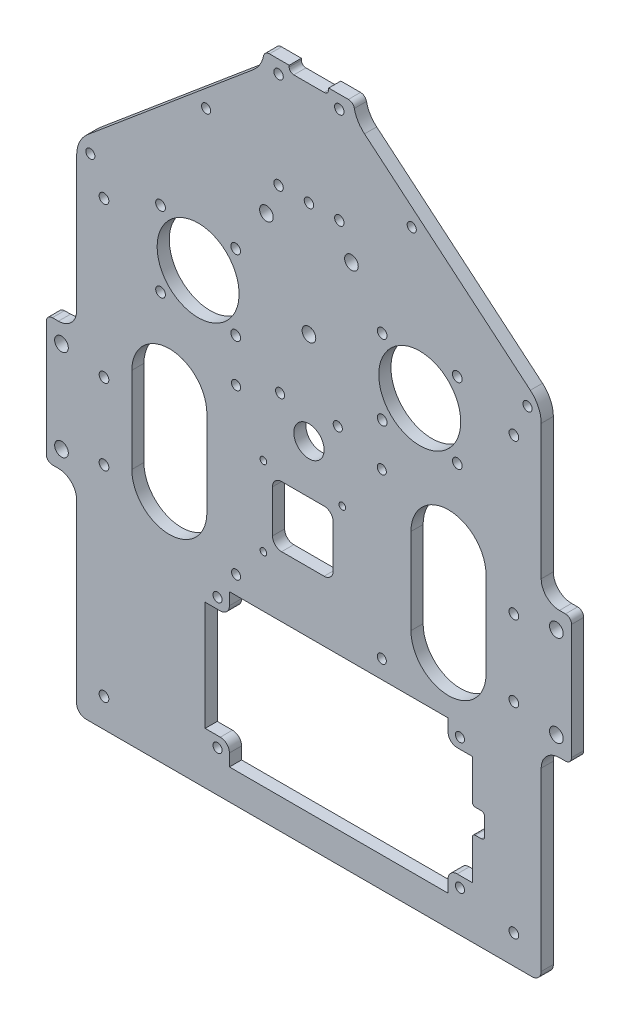
from build123d import *

# Parameters (mm, degrees)
SKETCH_1_R           = 2.25
SKETCH_1_R_2         = 13.5
SKETCH_1_R_3         = 1.6
SKETCH_1_R_4         = 1.55
EXTRUDE_1_DEPTH      = 4
SKETCH_2_R           = 2.25
EXTRUDE_2_DEPTH      = 4
CUT_EXTRUDE_2_DEPTH  = 10
SKETCH_6_R           = 2.25
EXTRUDE_3_DEPTH      = 4
SKETCH_7_R           = 2.25
SKETCH_7_R_2         = 2.390826743
EXTRUDE_5_DEPTH      = 4
SKETCH_10_R          = 1.6
CUT_EXTRUDE_3_DEPTH  = 6
SKETCH_11_W          = 153
SKETCH_11_H          = 60
EXTRUDE_6_DEPTH      = 4
SKETCH_12_R          = 1.5
CUT_EXTRUDE_4_DEPTH  = 10
SKETCH_14_W          = 10
SKETCH_14_H          = 42
SKETCH_14_R          = 2.25
EXTRUDE_7_DEPTH      = 4
FILLET_1_R           = 6
SKETCH_15_R          = 1.1
CUT_EXTRUDE_6_DEPTH  = 4
EXTRUDE_9_DEPTH      = 4
FILLET_8_R           = 2
SKETCH_18_W          = 88
SKETCH_18_H          = 50
CUT_EXTRUDE_7_DEPTH  = 10
SKETCH_19_W          = 8
SKETCH_19_H          = 7
EXTRUDE_10_DEPTH     = 4
FILLET_9_R           = 3
SKETCH_20_R          = 1.5
CUT_EXTRUDE_8_DEPTH  = 4
FILLET_10_R          = 3
SKETCH_21_W          = 8
SKETCH_21_H          = 8
CUT_EXTRUDE_10_DEPTH = 4
FILLET_12_R          = 1
CUT_EXTRUDE_11_DEPTH = 4
SKETCH_23_R          = 1.5
CUT_EXTRUDE_12_DEPTH = 10
SKETCH_24_R          = 1.5
CUT_EXTRUDE_13_DEPTH = 10
SKETCH_25_R          = 1.5
CUT_EXTRUDE_14_DEPTH = 10
SKETCH_27_R          = 5
CUT_EXTRUDE_15_DEPTH = 10
CUT_EXTRUDE_16_DEPTH = 10
FILLET_5_R           = 10
FILLET_6_R           = 10
SKETCH_31_R          = 1.6
CUT_EXTRUDE_17_DEPTH = 10


with BuildPart() as part:
    # 草图1 → 凸台-拉伸1 (new body)
    with BuildSketch(Plane.XY):
        with BuildLine():
            Line((-20.113876697, 33.24519052), (-46.760858936, 18.322520948))
            ThreePointArc((-46.760858936, 18.322520948), (-54.272689389, -11.186219731), (-24.417808219, -17.176164932))
            Line((-24.417808219, -17.176164932), (-17.260273973, -12.141356418))
            ThreePointArc((-17.260273973, -12.141356418), (0, -6.678734892), (17.260273973, -12.141356418))
            Line((17.260273973, -12.141356418), (24.417808219, -17.176164932))
            ThreePointArc((24.417808219, -17.176164932), (54.272689389, -11.186219731), (46.760858936, 18.322520948))
            Line((46.760858936, 18.322520948), (20.113876697, 33.24519052))
            ThreePointArc((20.113876697, 33.24519052), (16.372681963, 36.913582704), (15, 41.970200496))
            Line((15, 41.970200496), (15, 71.5))
            ThreePointArc((15, 71.5), (14.414213562, 72.914213562), (13, 73.5))
            Line((13, 73.5), (-13, 73.5))
            ThreePointArc((-13, 73.5), (-14.414213562, 72.914213562), (-15, 71.5))
            Line((-15, 71.5), (-15, 41.970200496))
            ThreePointArc((-15, 41.970200496), (-16.372681963, 36.913582704), (-20.113876697, 33.24519052))
        make_face()
        with Locations((-14, 27.5)):
            Circle(SKETCH_1_R, mode=Mode.SUBTRACT)
        with Locations((14, 27.5)):
            Circle(SKETCH_1_R, mode=Mode.SUBTRACT)
        with Locations((36.5, 0)):
            Circle(SKETCH_1_R_2, mode=Mode.SUBTRACT)
        with Locations((24.125631329, 12.374368671)):
            Circle(SKETCH_1_R_3, mode=Mode.SUBTRACT)
        with Locations((48.874368671, 12.374368671)):
            Circle(SKETCH_1_R_3, mode=Mode.SUBTRACT)
        with Locations((48.874368671, -12.374368671)):
            Circle(SKETCH_1_R_3, mode=Mode.SUBTRACT)
        with Locations((24.125631329, -12.374368671)):
            Circle(SKETCH_1_R_3, mode=Mode.SUBTRACT)
        Circle(SKETCH_1_R, mode=Mode.SUBTRACT)
        with Locations(Location((-24.125631329, -12.374368671, 0), (0, 0, 180))):
            Circle(SKETCH_1_R_3, mode=Mode.SUBTRACT)
        with Locations(Location((-48.874368671, -12.374368671, 0), (0, 0, 180))):
            Circle(SKETCH_1_R_3, mode=Mode.SUBTRACT)
        with Locations(Location((-48.874368671, 12.374368671, 0), (0, 0, 180))):
            Circle(SKETCH_1_R_3, mode=Mode.SUBTRACT)
        with Locations(Location((-24.125631329, 12.374368671, 0), (0, 0, 180))):
            Circle(SKETCH_1_R_3, mode=Mode.SUBTRACT)
        with Locations(Location((-36.5, 0, 0), (0, 0, 180))):
            Circle(SKETCH_1_R_2, mode=Mode.SUBTRACT)
        with Locations((-10, 37.5)):
            Circle(SKETCH_1_R_4, mode=Mode.SUBTRACT)
        with Locations((10, 37.5)):
            Circle(SKETCH_1_R_4, mode=Mode.SUBTRACT)
        with Locations((-10, 69.2)):
            Circle(SKETCH_1_R_4, mode=Mode.SUBTRACT)
        with Locations((10, 69.2)):
            Circle(SKETCH_1_R_4, mode=Mode.SUBTRACT)
        with Locations((0, 37.5)):
            Circle(SKETCH_1_R_4, mode=Mode.SUBTRACT)
    extrude(amount=EXTRUDE_1_DEPTH)

    # 草图2 → 凸台-拉伸2 (add)
    # profile 1 of 2: a face of its own
    with BuildSketch(Plane(origin=(0, 0, 0), x_dir=(-1, 0, 0), z_dir=(0, 0, -1))):
        with BuildLine():
            Line((34.034193738, -20.854730866), (72.253806486, -25.373713204))
            ThreePointArc((72.253806486, -25.373713204), (75.224328093, -24.440381608), (76.5, -21.6))
            Line((76.5, -21.6), (76.5, 3.4))
            ThreePointArc((76.5, 3.4), (75.861721596, 5.507965026), (74.16130708, 6.907788708))
            Line((74.16130708, 6.907788708), (46.760858936, 18.322520948))
            ThreePointArc((46.760858936, 18.322520948), (56.47260565, -6.488067781), (34.034193738, -20.854730866))
        make_face()
        with Locations((72.7, 3.4)):
            Circle(SKETCH_2_R, mode=Mode.SUBTRACT)
        with Locations((72.7, -21.6)):
            Circle(SKETCH_2_R, mode=Mode.SUBTRACT)
    # profile 2 of 2: a face of its own
    with BuildSketch(Plane(origin=(0, 0, 0), x_dir=(-1, 0, 0), z_dir=(0, 0, -1))):
        with BuildLine():
            Line((-74.16130708, 6.907788708), (-46.760858936, 18.322520948))
            ThreePointArc((-46.760858936, 18.322520948), (-56.47260565, -6.488067781), (-34.034193738, -20.854730866))
            Line((-34.034193738, -20.854730866), (-72.253806486, -25.373713204))
            ThreePointArc((-72.253806486, -25.373713204), (-75.224328093, -24.440381608), (-76.5, -21.6))
            Line((-76.5, -21.6), (-76.5, 3.4))
            ThreePointArc((-76.5, 3.4), (-75.861721596, 5.507965026), (-74.16130708, 6.907788708))
        make_face()
        with Locations((-72.7, 3.4)):
            Circle(SKETCH_2_R, mode=Mode.SUBTRACT)
        with Locations((-72.7, -21.6)):
            Circle(SKETCH_2_R, mode=Mode.SUBTRACT)
    extrude(amount=-EXTRUDE_2_DEPTH)

    # 草图4 → 切除-拉伸2 (cut)
    with BuildSketch(Plane(origin=(0, 0, 0), x_dir=(-1, 0, 0), z_dir=(0, 0, -1))):
        with BuildLine():
            Line((6.5, 73.5), (-6.5, 73.5))
            Line((-6.5, 73.5), (-6.5, 73))
            ThreePointArc((-6.5, 73), (-6.060660172, 71.939339828), (-5, 71.5))
            Line((-5, 71.5), (5, 71.5))
            ThreePointArc((5, 71.5), (6.060660172, 71.939339828), (6.5, 73))
            Line((6.5, 73), (6.5, 73.5))
        make_face()
    extrude(amount=-CUT_EXTRUDE_2_DEPTH, mode=Mode.SUBTRACT)

    # 草图6 → 凸台-拉伸3 (add)
    with BuildSketch(Plane.XY):
        Polygon((-76.5, 3.4), (-76.5, -86.5), (76.5, -86.5), (76.5, 3.4), (53.144000112, -23.114222035), (20.839041096, -14.658760675), (2.25, 0), (2.25, -4.271102927), (-2.25, -4.271102927), (-2.25, 0), (-20.839041096, -14.658760675), (-53.144000112, -23.114222035), align=None)
        with Locations(Location((-72.7, -21.6, 0), (0, 0, 180))):
            Circle(SKETCH_6_R, mode=Mode.SUBTRACT)
        with Locations(Location((72.7, -21.6, 0), (0, 0, 180))):
            Circle(SKETCH_6_R, mode=Mode.SUBTRACT)
    extrude(amount=EXTRUDE_3_DEPTH)

    # 草图7 → 凸台-拉伸5 (add)
    with BuildSketch(Plane.XY):
        with Locations((-72.7, -21.6)):
            Circle(SKETCH_7_R)
        with Locations((72.7, 3.4)):
            Circle(SKETCH_7_R_2)
        with Locations((72.7, -21.6)):
            Circle(SKETCH_7_R)
        with Locations((-72.7, 3.4)):
            Circle(SKETCH_7_R)
    extrude(amount=EXTRUDE_5_DEPTH)

    # 草图10 → 切除-拉伸3 (cut)
    with BuildSketch(Plane.XY.offset(4)):
        with Locations((67.5, -46)):
            Circle(SKETCH_10_R)
        with Locations(Location((67.5, -71, 0), (0, 0, 180))):
            Circle(SKETCH_10_R)
        with Locations((-67.5, -71)):
            Circle(SKETCH_10_R)
        with Locations(Location((-67.5, -46, 0), (0, 0, 180))):
            Circle(SKETCH_10_R)
    extrude(amount=-CUT_EXTRUDE_3_DEPTH, mode=Mode.SUBTRACT)

    # 草图11 → 凸台-拉伸6 (add)
    with BuildSketch(Plane.XY):
        with Locations((0, -116.5)):
            Rectangle(SKETCH_11_W, SKETCH_11_H)
    extrude(amount=EXTRUDE_6_DEPTH)

    # 草图12 → 切除-拉伸4 (cut)
    with BuildSketch(Plane.XY.offset(4)):
        with Locations((24, -26.5)):
            Circle(SKETCH_12_R)
        with Locations(Location((-24, -26.5, 0), (0, 0, 180))):
            Circle(SKETCH_12_R)
        with Locations(Location((24, -80.5, 0), (0, 0, 180))):
            Circle(SKETCH_12_R)
        with Locations((-24, -80.5)):
            Circle(SKETCH_12_R)
    extrude(amount=-CUT_EXTRUDE_4_DEPTH, mode=Mode.SUBTRACT)

    # 草图14 → 凸台-拉伸7 (add)
    # profile 1 of 2: a face of its own
    with BuildSketch(Plane.XY.offset(4)):
        with Locations((-81.5, -58.5)):
            Rectangle(SKETCH_14_W, SKETCH_14_H)
        with Locations((-81.5, -43.5)):
            Circle(SKETCH_14_R, mode=Mode.SUBTRACT)
        with Locations((-81.5, -73.5)):
            Circle(SKETCH_14_R, mode=Mode.SUBTRACT)
    # profile 2 of 2: a face of its own
    with BuildSketch(Plane.XY.offset(4)):
        with Locations((81.5, -58.5)):
            Rectangle(SKETCH_14_W, SKETCH_14_H)
        with Locations(Location((81.5, -73.5, 0), (0, 0, 180))):
            Circle(SKETCH_14_R, mode=Mode.SUBTRACT)
        with Locations(Location((81.5, -43.5, 0), (0, 0, 180))):
            Circle(SKETCH_14_R, mode=Mode.SUBTRACT)
    extrude(amount=-EXTRUDE_7_DEPTH)

    # 圆角1
    fillet_1_edges = [part.edges().sort_by_distance(p)[0] for p in [
        (-76.5, -37.5, 2),
        (-76.5, -79.5, 2),
        (76.5, -37.5, 2),
        (76.5, -79.5, 2),
    ]]
    fillet(fillet_1_edges, radius=FILLET_1_R)

    # 草图15 → 切除-拉伸6 (cut)
    with BuildSketch(Plane.XY.offset(4)):
        with Locations((-15, -43.5)):
            Circle(SKETCH_15_R)
        with Locations((11, -43.5)):
            Circle(SKETCH_15_R)
        with Locations((-15, -69.5)):
            Circle(SKETCH_15_R)
    extrude(amount=-CUT_EXTRUDE_6_DEPTH, mode=Mode.SUBTRACT)

    # 草图17 → 凸台-拉伸9 (add)
    with BuildSketch(Plane.XY.offset(4)):
        Polygon((-76.5, 2.850902071), (-76.5, 17.5), (-15, 69.104627317), (-15, 31.936807034), align=None)
        Polygon((15, 31.936807034), (76.5, 2.850902071), (76.5, 17.5), (15, 69.104627317), align=None)
    extrude(amount=-EXTRUDE_9_DEPTH)

    # 圆角8
    fillet_8_edges = [part.edges().sort_by_distance(p)[0] for p in [
        (-86.5, -79.5, 2),
        (-86.5, -37.5, 2),
        (86.5, -37.5, 2),
        (86.5, -79.5, 2),
    ]]
    fillet(fillet_8_edges, radius=FILLET_8_R)

    # 草图18 → 切除-拉伸7 (cut)
    with BuildSketch(Plane.XY.offset(4)):
        with Locations((9.819218434, -111.5)):
            Rectangle(SKETCH_18_W, SKETCH_18_H)
    extrude(amount=-CUT_EXTRUDE_7_DEPTH, mode=Mode.SUBTRACT)

    # 草图19 → 凸台-拉伸10 (add)
    with BuildSketch(Plane.XY.offset(4)):
        with Locations((49.819218434, -90)):
            Rectangle(SKETCH_19_W, SKETCH_19_H)
        with Locations((-30.180781566, -90)):
            Rectangle(SKETCH_19_W, SKETCH_19_H)
        with Locations((49.819218434, -133)):
            Rectangle(SKETCH_19_W, SKETCH_19_H)
        with Locations((-30.180781566, -133)):
            Rectangle(SKETCH_19_W, SKETCH_19_H)
    extrude(amount=-EXTRUDE_10_DEPTH)

    # 圆角9
    fillet_9_edges = [part.edges().sort_by_distance(p)[0] for p in [
        (-26.180781566, -93.5, 2),
        (45.819218434, -93.5, 2),
        (45.819218434, -129.5, 2),
        (-26.180781566, -129.5, 2),
    ]]
    fillet(fillet_9_edges, radius=FILLET_9_R)

    # 草图20 → 切除-拉伸8 (cut)
    with BuildSketch(Plane.XY.offset(4)):
        with Locations((49.744218434, -90.025)):
            Circle(SKETCH_20_R)
        with Locations(Location((-30.105781566, -90.025, 0), (0, 0, 180))):
            Circle(SKETCH_20_R)
        with Locations(Location((49.744218434, -132.975, 0), (0, 0, 180))):
            Circle(SKETCH_20_R)
        with Locations((-30.105781566, -132.975)):
            Circle(SKETCH_20_R)
    extrude(amount=-CUT_EXTRUDE_8_DEPTH, mode=Mode.SUBTRACT)

    # 圆角10
    fillet_10_edges = [part.edges().sort_by_distance(p)[0] for p in [
        (-76.5, -146.5, 2),
        (76.5, -146.5, 2),
    ]]
    fillet(fillet_10_edges, radius=FILLET_10_R)

    # 草图21 → 切除-拉伸10 (cut)
    with BuildSketch(Plane.XY):
        with Locations((53.819218434, -111.5)):
            Rectangle(SKETCH_21_W, SKETCH_21_H)
    extrude(amount=CUT_EXTRUDE_10_DEPTH, mode=Mode.SUBTRACT)

    # 圆角12
    fillet_12_edges = [part.edges().sort_by_distance(p)[0] for p in [
        (53.819218434, -115.5, 2),
        (53.819218434, -107.5, 2),
        (57.819218434, -107.5, 2),
        (57.819218434, -115.5, 2),
    ]]
    fillet(fillet_12_edges, radius=FILLET_12_R)

    # 草图22 → 切除-拉伸11 (cut)
    with BuildSketch(Plane.XY.offset(4)):
        with BuildLine():
            Line((58.332035048, -39.43466915), (58.332035048, -67.717636053))
            ThreePointArc((58.332035048, -67.717636053), (45.971330995, -80.078340107), (33.610626941, -67.717636053))
            Line((33.610626941, -67.717636053), (33.610626941, -39.43466915))
            ThreePointArc((33.610626941, -39.43466915), (45.971330995, -27.073965096), (58.332035048, -39.43466915))
        make_face()
        with BuildLine():
            Line((-58.332035048, -39.43466915), (-58.332035048, -67.717636053))
            ThreePointArc((-58.332035048, -67.717636053), (-45.971330995, -80.078340107), (-33.610626941, -67.717636053))
            Line((-33.610626941, -67.717636053), (-33.610626941, -39.43466915))
            ThreePointArc((-33.610626941, -39.43466915), (-45.971330995, -27.073965096), (-58.332035048, -39.43466915))
        make_face()
    extrude(amount=-CUT_EXTRUDE_11_DEPTH, mode=Mode.SUBTRACT)

    # 草图23 → 切除-拉伸12 (cut)
    with BuildSketch(Plane(origin=(0, 0, 0), x_dir=(-1, 0, 0), z_dir=(0, 0, -1))):
        with Locations((-9.5, -21.5)):
            Circle(SKETCH_23_R)
        with Locations((9.5, -21.5)):
            Circle(SKETCH_23_R)
    extrude(amount=-CUT_EXTRUDE_12_DEPTH, mode=Mode.SUBTRACT)

    # 草图24 → 切除-拉伸13 (cut)
    with BuildSketch(Plane.XY.offset(4)):
        with Locations((-72, 15.5)):
            Circle(SKETCH_24_R)
        with Locations(Location((72, 15.5, 0), (0, 0, 180))):
            Circle(SKETCH_24_R)
    extrude(amount=-CUT_EXTRUDE_13_DEPTH, mode=Mode.SUBTRACT)

    # 草图25 → 切除-拉伸14 (cut)
    with BuildSketch(Plane.XY.offset(4)):
        with Locations((-33.863885037, 47.5)):
            Circle(SKETCH_25_R)
        with Locations(Location((33.863885037, 47.5, 0), (0, 0, 180))):
            Circle(SKETCH_25_R)
    extrude(amount=-CUT_EXTRUDE_14_DEPTH, mode=Mode.SUBTRACT)

    # 草图27 → 切除-拉伸15 (cut)
    with BuildSketch(Plane.XY.offset(4)):
        with Locations((0, -30.5)):
            Circle(SKETCH_27_R)
    extrude(amount=-CUT_EXTRUDE_15_DEPTH, mode=Mode.SUBTRACT)

    # 草图28 → 切除-拉伸16 (cut)
    with BuildSketch(Plane.XY.offset(4)):
        with BuildLine():
            Line((5, -66.5), (-9, -66.5))
            ThreePointArc((-9, -66.5), (-11.121320344, -65.621320344), (-12, -63.5))
            Line((-12, -63.5), (-12, -49.5))
            ThreePointArc((-12, -49.5), (-11.121320344, -47.378679656), (-9, -46.5))
            Line((-9, -46.5), (5, -46.5))
            ThreePointArc((5, -46.5), (7.121320344, -47.378679656), (8, -49.5))
            Line((8, -49.5), (8, -63.5))
            ThreePointArc((8, -63.5), (7.121320344, -65.621320344), (5, -66.5))
        make_face()
    extrude(amount=-CUT_EXTRUDE_16_DEPTH, mode=Mode.SUBTRACT)

    # 圆角5
    fillet_5_edges = [part.edges().sort_by_distance(p)[0] for p in [
        (-76.5, 17.5, 2),
        (76.5, 17.5, 2),
    ]]
    fillet(fillet_5_edges, radius=FILLET_5_R)

    # 圆角6
    fillet_6_edges = [part.edges().sort_by_distance(p)[0] for p in [
        (-15, 69.104627317, 2),
        (15, 69.104627317, 2),
    ]]
    fillet(fillet_6_edges, radius=FILLET_6_R)

    # 草图31 → 切除-拉伸17 (cut)
    with BuildSketch(Plane.XY.offset(4)):
        with Locations((-67.5, 5)):
            Circle(SKETCH_31_R)
        with Locations((-67.5, -137)):
            Circle(SKETCH_31_R)
        with Locations(Location((67.5, 5, 0), (0, 0, 180))):
            Circle(SKETCH_31_R)
        with Locations(Location((67.5, -137, 0), (0, 0, 180))):
            Circle(SKETCH_31_R)
    extrude(amount=-CUT_EXTRUDE_17_DEPTH, mode=Mode.SUBTRACT)


solid = part.part
